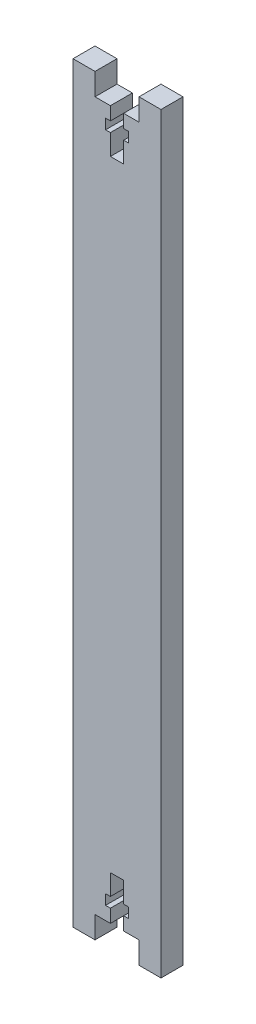
from build123d import *

# Parameters (mm, degrees)
BOSS_EXTRUDE1_DEPTH = 5


with BuildPart() as part:
    # Sketch1 → Boss-Extrude1 (new body)
    with BuildSketch(Plane.XY):
        Polygon((0, 166), (0, 5), (0, 0), (-5, 0), (-5, 5), (-8.5, 5), (-8.5, 8), (-7.4, 8), (-7.4, 10.3), (-8.5, 10.3), (-8.5, 15), (-11.5, 15), (-11.5, 10.3), (-12.6, 10.3), (-12.6, 8), (-11.5, 8), (-11.5, 5), (-15, 5), (-15, 0), (-20, 0), (-20, 5), (-20, 166), (-20, 171), (-15, 171), (-15, 166), (-11.5, 166), (-11.5, 163), (-12.6, 163), (-12.6, 160.7), (-11.5, 160.7), (-11.5, 156), (-8.5, 156), (-8.5, 160.7), (-7.4, 160.7), (-7.4, 163), (-8.5, 163), (-8.5, 166), (-5, 166), (-5, 171), (0, 171), align=None)
    extrude(amount=BOSS_EXTRUDE1_DEPTH)


solid = part.part
